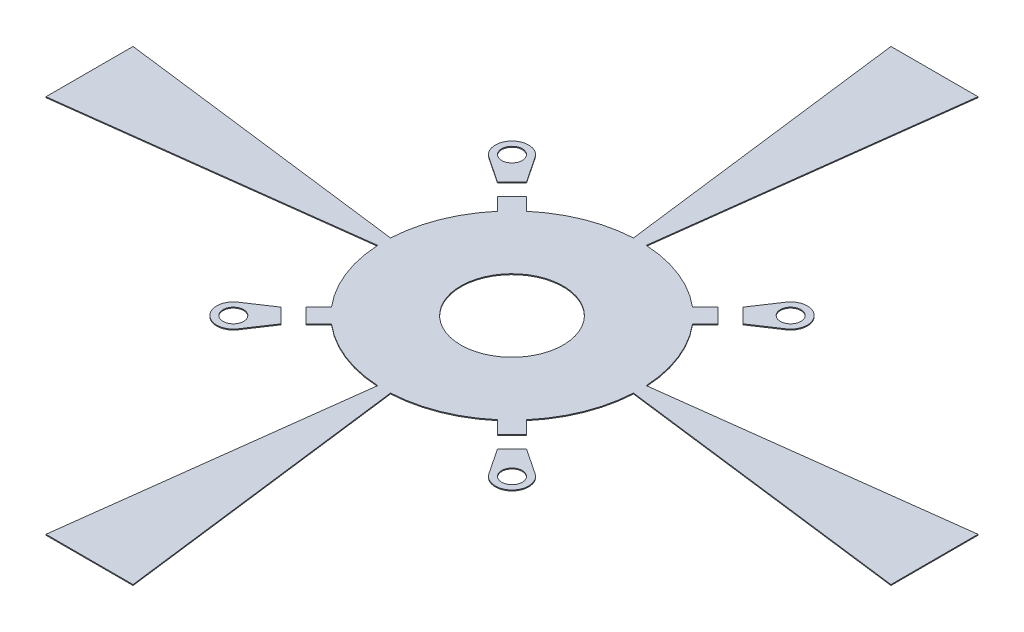
from build123d import *

# Parameters (mm, degrees)
SKETCH1_W           = 33
SKETCH1_H           = 33
BOSS_EXTRUDE1_DEPTH = 0.035
SKETCH3_R           = 0.4
CUT_EXTRUDE2_DEPTH  = 24.334550028


with BuildPart() as part:
    # Sketch1 → Boss-Extrude1 (new body)
    with BuildSketch(Plane(origin=(0, 0, 0), x_dir=(1, 0, 0), z_dir=(0, 1, 0))):
        Rectangle(SKETCH1_W, SKETCH1_H)
    extrude(amount=BOSS_EXTRUDE1_DEPTH)

    # Sketch3 → Cut-Extrude2 (cut, through all)
    # profile 1 of 9: a face of its own
    with BuildSketch(Plane(origin=(0, 0.035, 0), x_dir=(1, 0, 0), z_dir=(0, 1, 0))):
        with BuildLine():
            Line((-4.993746089, -0.25), (-16.5, -1.7))
            Line((-16.5, -1.7), (-16.5, -16.5))
            Line((-16.5, -16.5), (-1.7, -16.5))
            Line((-1.7, -16.5), (-0.25, -4.993746089))
            ThreePointArc((-0.25, -4.993746089), (-1.843763136, -4.647637841), (-3.241359325, -3.80704475))
            Line((-3.241359325, -3.80704475), (-3.736334072, -4.302019497))
            Line((-3.736334072, -4.302019497), (-4.302019497, -3.736334072))
            Line((-4.302019497, -3.736334072), (-3.80704475, -3.241359325))
            ThreePointArc((-3.80704475, -3.241359325), (-4.647637841, -1.843763136), (-4.993746089, -0.25))
        make_face()
        with BuildLine():
            ThreePointArc((-4.900453872, -5.80175516), (-5.901078763, -5.901078763), (-5.80175516, -4.900453872))
            Line((-5.80175516, -4.900453872), (-4.796994243, -4.231308819))
            Line((-4.796994243, -4.231308819), (-4.231308819, -4.796994243))
            Line((-4.231308819, -4.796994243), (-4.900453872, -5.80175516))
        make_face(mode=Mode.SUBTRACT)
    # profile 2 of 9: a face of its own
    with BuildSketch(Plane(origin=(0, 0.035, 0), x_dir=(1, 0, 0), z_dir=(0, 1, 0))):
        with BuildLine():
            ThreePointArc((0, 2), (-1.414213562, 1.414213562), (-2, 0))
            ThreePointArc((-2, 0), (-1.414213562, -1.414213562), (0, -2))
            ThreePointArc((0, -2), (1.414213562, -1.414213562), (2, 0))
            ThreePointArc((2, 0), (1.414213562, 1.414213562), (0, 2))
        make_face()
    # profile 3 of 9: a face of its own
    with BuildSketch(Plane(origin=(0, 0.035, 0), x_dir=(1, 0, 0), z_dir=(0, 1, 0))):
        with BuildLine():
            Line((-16.5, 16.5), (-16.5, 1.7))
            Line((-16.5, 1.7), (-4.993746089, 0.25))
            ThreePointArc((-4.993746089, 0.25), (-4.647637841, 1.843763136), (-3.80704475, 3.241359325))
            Line((-3.80704475, 3.241359325), (-4.302019497, 3.736334072))
            Line((-4.302019497, 3.736334072), (-3.736334072, 4.302019497))
            Line((-3.736334072, 4.302019497), (-3.241359325, 3.80704475))
            ThreePointArc((-3.241359325, 3.80704475), (-1.843763136, 4.647637841), (-0.25, 4.993746089))
            Line((-0.25, 4.993746089), (-1.7, 16.5))
            Line((-1.7, 16.5), (-16.5, 16.5))
        make_face()
        with BuildLine():
            ThreePointArc((-5.80175516, 4.900453872), (-5.901078763, 5.901078763), (-4.900453872, 5.80175516))
            Line((-4.900453872, 5.80175516), (-4.231308819, 4.796994243))
            Line((-4.231308819, 4.796994243), (-4.796994243, 4.231308819))
            Line((-4.796994243, 4.231308819), (-5.80175516, 4.900453872))
        make_face(mode=Mode.SUBTRACT)
    # profile 4 of 9: a face of its own
    with BuildSketch(Plane(origin=(0, 0.035, 0), x_dir=(1, 0, 0), z_dir=(0, 1, 0))):
        with Locations(Location((-5.441459355, -5.441459355, 0), (0, 0, 270))):
            Circle(SKETCH3_R)
    # profile 5 of 9: a face of its own
    with BuildSketch(Plane(origin=(0, 0.035, 0), x_dir=(1, 0, 0), z_dir=(0, 1, 0))):
        with BuildLine():
            Line((0.25, -4.993746089), (1.7, -16.5))
            Line((1.7, -16.5), (16.5, -16.5))
            Line((16.5, -16.5), (16.5, -1.7))
            Line((16.5, -1.7), (4.993746089, -0.25))
            ThreePointArc((4.993746089, -0.25), (4.647637841, -1.843763136), (3.80704475, -3.241359325))
            Line((3.80704475, -3.241359325), (4.302019497, -3.736334072))
            Line((4.302019497, -3.736334072), (3.736334072, -4.302019497))
            Line((3.736334072, -4.302019497), (3.241359325, -3.80704475))
            ThreePointArc((3.241359325, -3.80704475), (1.843763136, -4.647637841), (0.25, -4.993746089))
        make_face()
        with BuildLine():
            ThreePointArc((5.80175516, -4.900453872), (5.901078763, -5.901078763), (4.900453872, -5.80175516))
            Line((4.900453872, -5.80175516), (4.231308819, -4.796994243))
            Line((4.231308819, -4.796994243), (4.796994243, -4.231308819))
            Line((4.796994243, -4.231308819), (5.80175516, -4.900453872))
        make_face(mode=Mode.SUBTRACT)
    # profile 6 of 9: a face of its own
    with BuildSketch(Plane(origin=(0, 0.035, 0), x_dir=(1, 0, 0), z_dir=(0, 1, 0))):
        with BuildLine():
            Line((16.5, 16.5), (1.7, 16.5))
            Line((1.7, 16.5), (0.25, 4.993746089))
            ThreePointArc((0.25, 4.993746089), (1.843763136, 4.647637841), (3.241359325, 3.80704475))
            Line((3.241359325, 3.80704475), (3.736334072, 4.302019497))
            Line((3.736334072, 4.302019497), (4.302019497, 3.736334072))
            Line((4.302019497, 3.736334072), (3.80704475, 3.241359325))
            ThreePointArc((3.80704475, 3.241359325), (4.647637841, 1.843763136), (4.993746089, 0.25))
            Line((4.993746089, 0.25), (16.5, 1.7))
            Line((16.5, 1.7), (16.5, 16.5))
        make_face()
        with BuildLine():
            ThreePointArc((4.900453872, 5.80175516), (5.901078763, 5.901078763), (5.80175516, 4.900453872))
            Line((5.80175516, 4.900453872), (4.796994243, 4.231308819))
            Line((4.796994243, 4.231308819), (4.231308819, 4.796994243))
            Line((4.231308819, 4.796994243), (4.900453872, 5.80175516))
        make_face(mode=Mode.SUBTRACT)
    # profile 7 of 9: a face of its own
    with BuildSketch(Plane(origin=(0, 0.035, 0), x_dir=(1, 0, 0), z_dir=(0, 1, 0))):
        with Locations(Location((5.441459355, 5.441459355, 0), (0, 0, 270))):
            Circle(SKETCH3_R)
    # profile 8 of 9: a face of its own
    with BuildSketch(Plane(origin=(0, 0.035, 0), x_dir=(1, 0, 0), z_dir=(0, 1, 0))):
        with Locations(Location((-5.441459355, 5.441459355, 0), (0, 0, 270))):
            Circle(SKETCH3_R)
    # profile 9 of 9: a face of its own
    with BuildSketch(Plane(origin=(0, 0.035, 0), x_dir=(1, 0, 0), z_dir=(0, 1, 0))):
        with Locations(Location((5.441459355, -5.441459355, 0), (0, 0, 270))):
            Circle(SKETCH3_R)
    extrude(amount=-CUT_EXTRUDE2_DEPTH, mode=Mode.SUBTRACT)


with BuildPart() as cut_extrude2_piece_1:
    # of the separate pieces the step leaves, piece 1, a body of its own (cut_extrude2_pieces)
    add(part.part.solids().sort_by_distance((-1.7, 0, 16.5))[0])


with BuildPart() as cut_extrude2_piece_2:
    # of the separate pieces the step leaves, piece 2, a body of its own (cut_extrude2_pieces)
    add(part.part.solids().sort_by_distance((5.80175516, 0, -4.900453872))[0])


with BuildPart() as cut_extrude2_piece_3:
    # of the separate pieces the step leaves, piece 3, a body of its own (cut_extrude2_pieces)
    add(part.part.solids().sort_by_distance((-5.80175516, 0, 4.900453872))[0])


with BuildPart() as cut_extrude2_piece_4:
    # of the separate pieces the step leaves, piece 4, a body of its own (cut_extrude2_pieces)
    add(part.part.solids().sort_by_distance((-4.900453872, 0, -5.80175516))[0])


with BuildPart() as cut_extrude2_piece_5:
    # of the separate pieces the step leaves, piece 5, a body of its own (cut_extrude2_pieces)
    add(part.part.solids().sort_by_distance((4.900453872, 0, 5.80175516))[0])


solid = Compound([cut_extrude2_piece_1.part, cut_extrude2_piece_2.part, cut_extrude2_piece_3.part, cut_extrude2_piece_4.part, cut_extrude2_piece_5.part])
